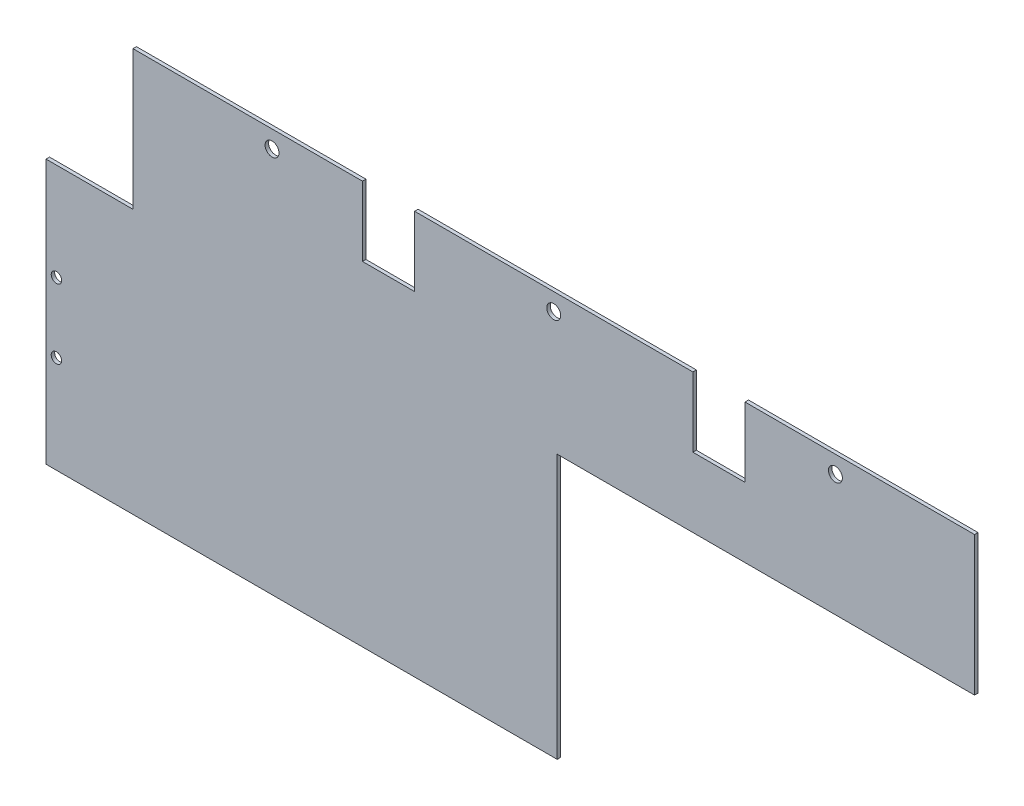
from build123d import *

# Parameters (mm, degrees)
SKETCH_1_R          = 1.5
EXTRUDE_1_DEPTH     = 1
SKETCH_2_R          = 2
SKETCH_2_W          = 15
SKETCH_2_H          = 20
CUT_EXTRUDE_1_DEPTH = 315.198981539
SKETCH_3_W          = 145
SKETCH_3_H          = 76
CUT_EXTRUDE_2_DEPTH = 315.198981539


with BuildPart() as part:
    # 草图1 → 凸台-拉伸1 (new body)
    with BuildSketch(Plane.XY):
        Polygon((0, 0), (0, 76), (25, 76), (25, 116), (267, 116), (267, 76), (292, 76), (292, 0), align=None)
        with Locations((3, 48)):
            Circle(SKETCH_1_R, mode=Mode.SUBTRACT)
        with Locations((3, 28)):
            Circle(SKETCH_1_R, mode=Mode.SUBTRACT)
        with Locations(Location((289, 28, 0), (0, 0, 180))):
            Circle(SKETCH_1_R, mode=Mode.SUBTRACT)
        with Locations(Location((289, 48, 0), (0, 0, 180))):
            Circle(SKETCH_1_R, mode=Mode.SUBTRACT)
    extrude(amount=EXTRUDE_1_DEPTH)

    # 草图2 → 切除-拉伸1 (cut, through all)
    with BuildSketch(Plane.XY.offset(1)):
        with Locations((65, 111)):
            Circle(SKETCH_2_R)
        with Locations(Location((227, 111, 0), (0, 0, 180))):
            Circle(SKETCH_2_R)
        with Locations((146, 111)):
            Circle(SKETCH_2_R)
        with Locations((193.5, 106)):
            Rectangle(SKETCH_2_W, SKETCH_2_H)
        with Locations((98.5, 106)):
            Rectangle(SKETCH_2_W, SKETCH_2_H)
    extrude(amount=-CUT_EXTRUDE_1_DEPTH, mode=Mode.SUBTRACT)

    # 草图3 → 切除-拉伸2 (cut, through all)
    with BuildSketch(Plane.XY.offset(1)):
        with Locations((219.5, 38)):
            Rectangle(SKETCH_3_W, SKETCH_3_H)
    extrude(amount=-CUT_EXTRUDE_2_DEPTH, mode=Mode.SUBTRACT)


solid = part.part
